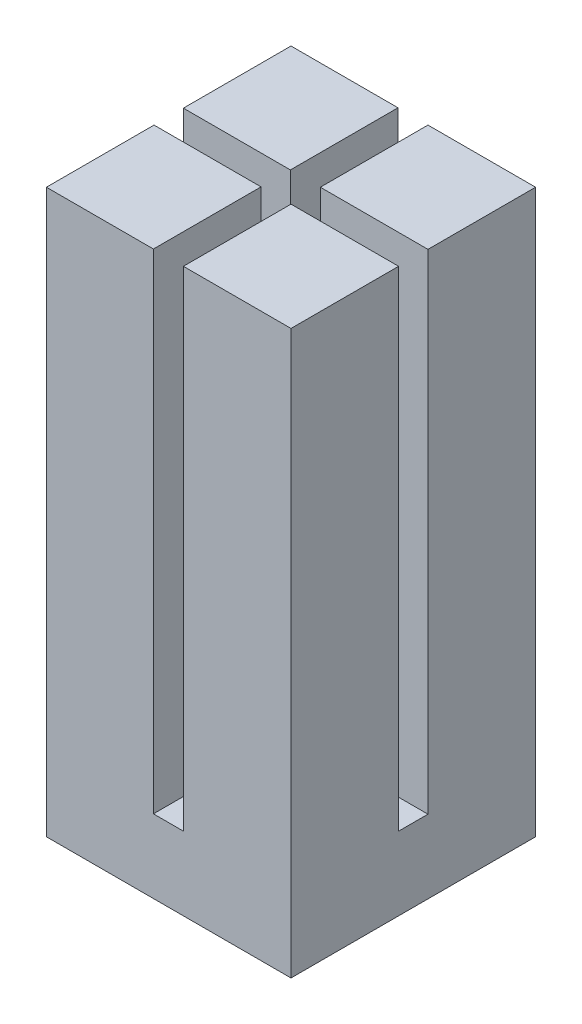
from build123d import *

# Parameters (mm, degrees)
SKETCH1_W             = 11.1125
SKETCH1_H             = 11.176
BOSS_EXTRUDE1_DEPTH   = 50.8
SKETCH1_W_2           = 11.176
BOSS_EXTRUDE1_2_DEPTH = 50.8
BOSS_EXTRUDE1_3_DEPTH = 50.8
BOSS_EXTRUDE1_4_DEPTH = 50.8
SKETCH1_4_W           = 25.4
SKETCH1_4_H           = 25.4
BOSS_EXTRUDE2_DEPTH   = 7.62


with BuildPart() as part:
    # Sketch1 → Boss-Extrude1 (new body)
    with BuildSketch(Plane(origin=(0, 0, 0), x_dir=(1, 0, 0), z_dir=(0, 1, 0))):
        with Locations((-7.14375, 7.112)):
            Rectangle(SKETCH1_W, SKETCH1_H)
    extrude(amount=BOSS_EXTRUDE1_DEPTH)



with BuildPart() as body_2:
    # Sketch1 → Boss-Extrude1 2 (new body)
    with BuildSketch(Plane(origin=(0, 0, 0), x_dir=(1, 0, 0), z_dir=(0, 1, 0))):
        with Locations((7.112, 7.112)):
            Rectangle(SKETCH1_W_2, SKETCH1_H)
    extrude(amount=BOSS_EXTRUDE1_2_DEPTH)


with BuildPart() as body_3:
    # Sketch1 → Boss-Extrude1 3 (new body)
    with BuildSketch(Plane(origin=(0, 0, 0), x_dir=(1, 0, 0), z_dir=(0, 1, 0))):
        with Locations((-7.14375, -7.112)):
            Rectangle(SKETCH1_W, SKETCH1_H)
    extrude(amount=BOSS_EXTRUDE1_3_DEPTH)


with BuildPart() as body_4:
    # Sketch1 → Boss-Extrude1 4 (new body)
    with BuildSketch(Plane(origin=(0, 0, 0), x_dir=(1, 0, 0), z_dir=(0, 1, 0))):
        with Locations((7.112, -7.112)):
            Rectangle(SKETCH1_W_2, SKETCH1_H)
    extrude(amount=BOSS_EXTRUDE1_4_DEPTH)


with BuildPart() as part_1:
    add(part.part)

    add(body_2.part)  # Boss-Extrude2 merges body 2

    add(body_3.part)  # Boss-Extrude2 merges body 3

    add(body_4.part)  # Boss-Extrude2 merges body 4
    # Sketch1<4> → Boss-Extrude2 (add)
    with BuildSketch(Plane(origin=(0, 0, 0), x_dir=(1, 0, 0), z_dir=(0, 1, 0))):
        Rectangle(SKETCH1_4_W, SKETCH1_4_H)
    extrude(amount=-BOSS_EXTRUDE2_DEPTH)


solid = part_1.part
